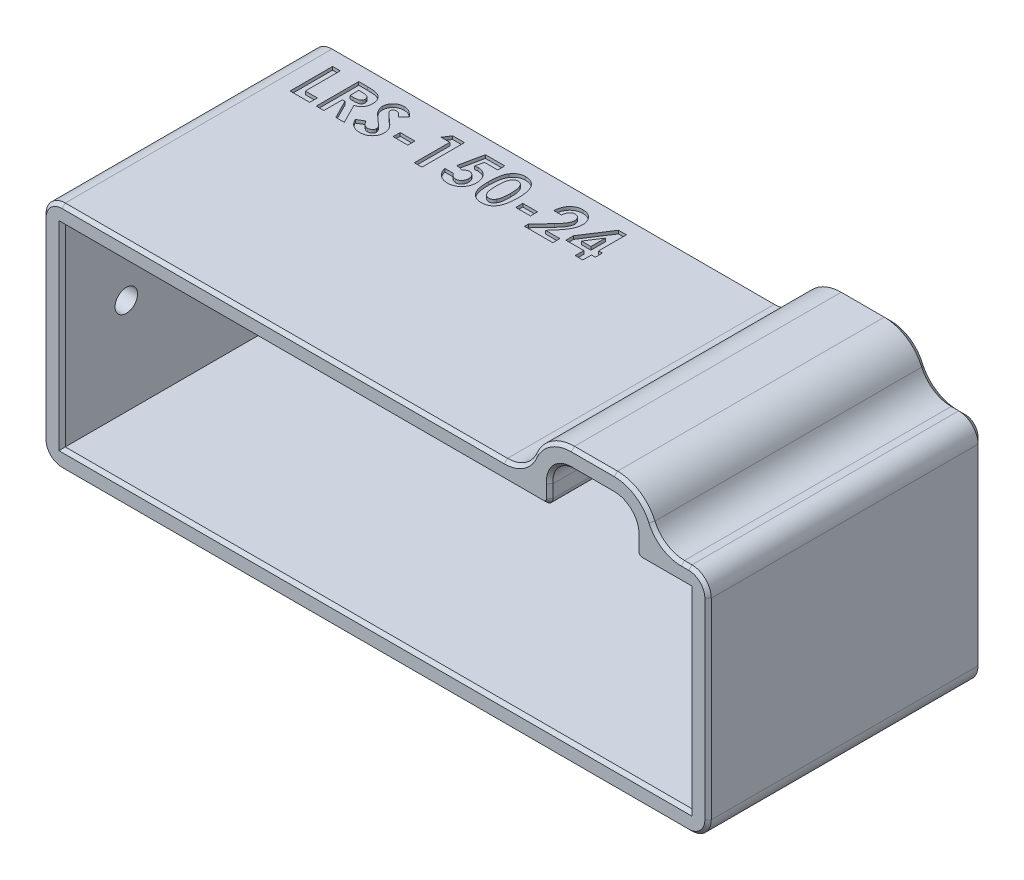
from build123d import *

# Parameters (mm, degrees)
SKETCH1_W           = 103.5
SKETCH1_H           = 36
SKETCH1_W_2         = 97.5
SKETCH1_H_2         = 30
BOSS_EXTRUDE1_DEPTH = 40
SKETCH1_2_W         = 103.5
SKETCH1_2_H         = 36
BOSS_EXTRUDE2_DEPTH = 3
SKETCH2_R           = 1.75
CUT_EXTRUDE1_DEPTH  = 3
BOSS_EXTRUDE3_DEPTH = 43
SKETCH4_W           = 13.363332499
SKETCH4_H           = 3
CUT_EXTRUDE3_DEPTH  = 40
CUT_EXTRUDE4_DEPTH  = 43
BOSS_EXTRUDE4_START = -3
BOSS_EXTRUDE4_DEPTH = 3
FILLET1_R           = 5
FILLET2_R           = 3
CHAMFER1_SIZE       = 1
SKETCH8_W           = 2.289663462
SKETCH8_H           = 1.102430556
SKETCH8_W_2         = 2.289663461
CUT_EXTRUDE5_DEPTH  = 0.5
FILLET3_R           = 1
CHAMFER2_SIZE       = 0.5
CHAMFER3_SIZE       = 0.5


with BuildPart() as part:
    # Sketch1 → Boss-Extrude1 (new body)
    with BuildSketch(Plane.XY):
        Rectangle(SKETCH1_W, SKETCH1_H)
        Rectangle(SKETCH1_W_2, SKETCH1_H_2, mode=Mode.SUBTRACT)
    extrude(amount=BOSS_EXTRUDE1_DEPTH)

    # Sketch1<2> → Boss-Extrude2 (add)
    with BuildSketch(Plane.XY):
        Rectangle(SKETCH1_2_W, SKETCH1_2_H)
    extrude(amount=-BOSS_EXTRUDE2_DEPTH)

    # Sketch2 → Cut-Extrude1 (cut)
    with BuildSketch(Plane.ZY.offset(51.75)):
        with Locations((30, 0)):
            Circle(SKETCH2_R)
    extrude(amount=-CUT_EXTRUDE1_DEPTH, mode=Mode.SUBTRACT)

    # Sketch3 → Boss-Extrude3 (add)
    with BuildSketch(Plane.XY.offset(40)):
        Polygon((-51.75, 24.7), (-51.75, 18), (-48.75, 18), (-48.75, 21.7), (30.470016264, 21.7), (37.170016264, 21.7), (48.75, 21.7), (48.75, 18), (51.75, 18), (51.75, 24.7), align=None)
        with BuildLine():
            Line((-48.75, 21.7), (-48.75, 18))
            Line((-48.75, 18), (27.138350015, 18))
            ThreePointArc((27.138350015, 18), (27.980538407, 20.591651177), (30.470016264, 21.7))
            Line((30.470016264, 21.7), (-48.75, 21.7))
        make_face()
        with BuildLine():
            ThreePointArc((37.170016264, 21.7), (39.659494121, 20.591651177), (40.501682514, 18))
            Line((40.501682514, 18), (48.75, 18))
            Line((48.75, 18), (48.75, 21.7))
            Line((48.75, 21.7), (37.170016264, 21.7))
        make_face()
    extrude(amount=-BOSS_EXTRUDE3_DEPTH)

    # Sketch4 → Cut-Extrude3 (cut)
    with BuildSketch(Plane.XY.offset(40)):
        with Locations((33.820016264, 16.5)):
            Rectangle(SKETCH4_W, SKETCH4_H)
    extrude(amount=-CUT_EXTRUDE3_DEPTH, mode=Mode.SUBTRACT)

    # Sketch6 → Cut-Extrude4 (cut)
    with BuildSketch(Plane.XY.offset(40)):
        with BuildLine():
            Line((-51.75, 17.867814868), (24.138350015, 17.867814868))
            ThreePointArc((24.138350015, 17.867814868), (25.812528981, 22.666284537), (30.470016264, 24.7))
            Line((30.470016264, 24.7), (-51.75, 24.7))
            Line((-51.75, 24.7), (-51.75, 17.867814868))
        make_face()
        with BuildLine():
            Line((43.501682514, 17.867814868), (51.75, 17.867814868))
            Line((51.75, 17.867814868), (51.75, 24.7))
            Line((51.75, 24.7), (37.170016264, 24.7))
            ThreePointArc((37.170016264, 24.7), (41.827503548, 22.666284537), (43.501682514, 17.867814868))
        make_face()
    extrude(amount=-CUT_EXTRUDE4_DEPTH, mode=Mode.SUBTRACT)

    # Sketch7 → Boss-Extrude4 (add)
    with BuildSketch(Plane(origin=(0, 0, -3), x_dir=(-1, 0, 0), z_dir=(0, 0, -1)).offset(BOSS_EXTRUDE4_START)):
        with BuildLine():
            Line((-40.501682514, 18), (-27.138350015, 18))
            ThreePointArc((-27.138350015, 18), (-27.980538407, 20.591651177), (-30.470016264, 21.7))
            Line((-30.470016264, 21.7), (-37.170016264, 21.7))
            ThreePointArc((-37.170016264, 21.7), (-39.659494121, 20.591651177), (-40.501682514, 18))
        make_face()
    extrude(amount=BOSS_EXTRUDE4_DEPTH)

    # Fillet1
    fillet1_edges = [part.edges().sort_by_distance(p)[0] for p in [
        (24.138350015, 17.867814868, 18.5),
        (43.501682514, 17.867814868, 18.5),
    ]]
    fillet(fillet1_edges, radius=FILLET1_R)

    # Fillet2
    fillet2_edges = [part.edges().sort_by_distance(p)[0] for p in [
        (-51.75, -18, 18.5),
        (51.75, -18, 18.5),
        (-51.75, 17.867814868, 18.5),
        (51.75, 17.867814868, 18.5),
    ]]
    fillet(fillet2_edges, radius=FILLET2_R)

    # Chamfer1
    chamfer1_edges = [part.edges().sort_by_distance(p)[0] for p in [
        (40.65371515, 23.659081095, -3),
        (-14.346042406, 17.867814868, -3),
        (44.839047351, 18.687436053, -3),
        (22.800985177, 18.687436053, -3),
        (51.75, -0.066092566, -3),
        (-51.75, -0.066092566, -3),
        (48.16605867, 17.867814868, -3),
        (0, -18, -3),
        (50.871320344, 16.989135212, -3),
        (-50.871320344, 16.989135212, -3),
        (-50.871320344, -17.121320344, -3),
        (50.871320344, -17.121320344, -3),
        (33.820016264, 24.7, -3),
        (26.986317378, 23.659081095, -3),
    ]]
    chamfer(chamfer1_edges, length=CHAMFER1_SIZE)

    # Sketch8 → Cut-Extrude5 (cut)
    # profile 1 of 10: a face of its own
    with BuildSketch(Plane(origin=(0, 17.867814868, 0), x_dir=(1, 0, 0), z_dir=(0, 1, 0))):
        Polygon((-46.353097305, -0.311028799), (-45.165864399, -0.311028799), (-45.165864399, -5.738379226), (-43.30021269, -5.738379226), (-43.30021269, -6.925612132), (-46.353097305, -6.925612132), align=None)
    # profile 2 of 10: a face of its own
    with BuildSketch(Plane(origin=(0, 17.867814868, 0), x_dir=(1, 0, 0), z_dir=(0, 1, 0))):
        with BuildLine():
            Line((-42.282584484, -0.311028799), (-40.899246143, -0.311028799))
            add(Edge.make_bspline(
                [(-40.899246143, -0.311028799), (-40.8078079, -0.311353352), (-40.631946401, -0.31197756), (-40.378363726, -0.321825899), (-40.145413165, -0.335530671), (-39.932749814, -0.356444517), (-39.740464655, -0.384173749), (-39.568364972, -0.416861926), (-39.416455797, -0.45411711), (-39.283455984, -0.50054001), (-39.163430229, -0.552904337), (-39.051549539, -0.613071909), (-38.94534566, -0.680372741), (-38.845528448, -0.7565777), (-38.75123047, -0.840315877), (-38.662273826, -0.931671564), (-38.579915557, -1.031419419), (-38.504665628, -1.138929161), (-38.436081375, -1.252026945), (-38.37546728, -1.370868054), (-38.326175797, -1.495535135), (-38.282621488, -1.624226478), (-38.25125073, -1.758781752), (-38.229432827, -1.897891037), (-38.213458612, -2.042044015), (-38.212540171, -2.139975147), (-38.212071664, -2.189930875)],
                knots=[0, 0, 0, 0, 1.749336639, 3.364467119, 4.854658419, 6.213483162, 7.451590619, 8.570285859, 9.5643256, 10.440900261, 11.26203566, 12.067320669, 12.869050712, 13.665104639, 14.467235401, 15.27997916, 16.102287765, 16.939272006, 17.78853747, 18.631303466, 19.488103222, 20.351255419, 21.228522269, 22.127379805, 23.044756219, 24, 24, 24, 24], degree=3))
            add(Edge.make_bspline(
                [(-38.212071664, -2.189930875), (-38.213288676, -2.24207318), (-38.215675014, -2.344314735), (-38.228529131, -2.49449924), (-38.252022419, -2.63818527), (-38.287606422, -2.77495213), (-38.328505611, -2.906502042), (-38.382891041, -3.030407828), (-38.444270374, -3.148471518), (-38.517168815, -3.259023058), (-38.597171292, -3.364518016), (-38.69021249, -3.460914491), (-38.790264769, -3.553393427), (-38.902952431, -3.636162258), (-39.0233081, -3.714817514), (-39.153723115, -3.786100121), (-39.293346345, -3.851801963), (-39.39150839, -3.888441848), (-39.441705745, -3.907178472)],
                knots=[0, 0, 0, 0, 1.099860209, 2.156625411, 3.176576793, 4.16617041, 5.135385252, 6.078461593, 7.016046972, 7.938469504, 8.868247731, 9.803980173, 10.76021508, 11.73834243, 12.748633912, 13.790971185, 14.870363756, 16, 16, 16, 16], degree=3))
            Line((-39.441705745, -3.907178472), (-37.915263437, -6.925612132))
            Line((-37.915263437, -6.925612132), (-39.235000016, -6.925612132))
            Line((-39.235000016, -6.925612132), (-40.692540414, -4.042332218))
            Line((-40.692540414, -4.042332218), (-41.095351578, -4.042332218))
            Line((-41.095351578, -4.042332218), (-41.095351578, -6.925612132))
            Line((-41.095351578, -6.925612132), (-42.282584484, -6.925612132))
            Line((-42.282584484, -6.925612132), (-42.282584484, -0.311028799))
        make_face()
        with BuildLine():
            Line((-41.095351578, -2.855099312), (-40.632913761, -2.855099312))
            add(Edge.make_bspline(
                [(-40.632913761, -2.855099312), (-40.576376894, -2.854462555), (-40.468120942, -2.853243304), (-40.312434664, -2.847587911), (-40.171034394, -2.833961209), (-40.043312912, -2.81674438), (-39.928627536, -2.796865064), (-39.828001217, -2.768376798), (-39.739883459, -2.7378509), (-39.665318459, -2.699915126), (-39.601611837, -2.656773924), (-39.546605246, -2.607764446), (-39.501106908, -2.551042216), (-39.463659456, -2.488148699), (-39.434529409, -2.418527618), (-39.413266706, -2.342943254), (-39.401384, -2.260534604), (-39.400016854, -2.203661414), (-39.39930457, -2.174030435)],
                knots=[0, 0, 0, 0, 1.688639943, 3.233382647, 4.650958383, 5.928841754, 7.082724185, 8.122798841, 9.049171256, 9.863274652, 10.613301712, 11.341792392, 12.054588806, 12.776240173, 13.521029143, 14.301969904, 15.115324896, 16, 16, 16, 16], degree=3))
            add(Edge.make_bspline(
                [(-39.39930457, -2.174030435), (-39.400651208, -2.138974823), (-39.40329643, -2.07011457), (-39.429545246, -1.97097995), (-39.471327692, -1.879224078), (-39.528599981, -1.795261527), (-39.600726983, -1.721654159), (-39.683498409, -1.656768678), (-39.778700665, -1.605462095), (-39.86685079, -1.571620819), (-39.9470468, -1.551373234), (-40.019421168, -1.536284913), (-40.103231123, -1.525591387), (-40.198539935, -1.514248999), (-40.30510466, -1.506894035), (-40.423506139, -1.501526377), (-40.553404324, -1.499330204), (-40.643955696, -1.498628126), (-40.691215377, -1.498261705)],
                knots=[0, 0, 0, 0, 1.020303359, 2.004196876, 2.966617323, 3.9489082, 4.950758222, 5.960522915, 7.003732012, 8.091992268, 8.70421221, 9.413913587, 10.24622431, 11.166358409, 12.212345909, 13.359657661, 14.621978493, 16, 16, 16, 16], degree=3))
            Line((-40.691215377, -1.498261705), (-41.095351578, -1.498261705))
            Line((-41.095351578, -1.498261705), (-41.095351578, -2.855099312))
        make_face(mode=Mode.SUBTRACT)
    # profile 3 of 10: a face of its own
    with BuildSketch(Plane(origin=(0, 17.867814868, 0), x_dir=(1, 0, 0), z_dir=(0, 1, 0))):
        with BuildLine():
            Line((-33.54794239, -1.194828295), (-34.435716996, -2.007075807))
            add(Edge.make_bspline(
                [(-34.435716996, -2.007075807), (-34.473745454, -1.953432715), (-34.546754789, -1.850445458), (-34.665095306, -1.712543093), (-34.782901455, -1.594902113), (-34.901264638, -1.498013968), (-35.021233981, -1.422467325), (-35.142601236, -1.368979468), (-35.264678337, -1.334976729), (-35.346695305, -1.33074257), (-35.387093365, -1.328657004)],
                knots=[0, 0, 0, 0, 1.299362458, 2.494594718, 3.587462134, 4.587049575, 5.512617175, 6.380583204, 7.202344345, 8, 8, 8, 8], degree=3))
            add(Edge.make_bspline(
                [(-35.387093365, -1.328657004), (-35.424775518, -1.329978514), (-35.497529853, -1.332530004), (-35.601246556, -1.357891618), (-35.693327722, -1.40166204), (-35.773683484, -1.45889555), (-35.837337103, -1.527848659), (-35.888159581, -1.600162742), (-35.916776907, -1.679981135), (-35.92054351, -1.734803627), (-35.922408202, -1.761944013)],
                knots=[0, 0, 0, 0, 1.185010067, 2.2879431, 3.333075148, 4.379039566, 5.372662701, 6.27520591, 7.14612461, 8, 8, 8, 8], degree=3))
            add(Edge.make_bspline(
                [(-35.922408202, -1.761944013), (-35.921239694, -1.789475775), (-35.918886482, -1.844920918), (-35.896157651, -1.92618268), (-35.861898813, -2.005584882), (-35.829163095, -2.05392078), (-35.812430154, -2.078627791)],
                knots=[0, 0, 0, 0, 0.967525499, 1.948461899, 2.951351359, 4, 4, 4, 4], degree=3))
            add(Edge.make_bspline(
                [(-35.812430154, -2.078627791), (-35.797218101, -2.097832291), (-35.762201962, -2.142038516), (-35.695433358, -2.212054286), (-35.611586014, -2.297829732), (-35.507433307, -2.396415288), (-35.387298903, -2.511356477), (-35.245614417, -2.638134917), (-35.086458147, -2.780676788), (-34.973333557, -2.879937786), (-34.914055254, -2.931951442)],
                knots=[0, 0, 0, 0, 0.473873513, 1.090794244, 1.870441696, 2.795289791, 3.865433203, 5.087734844, 6.473946851, 8, 8, 8, 8], degree=3))
            add(Edge.make_bspline(
                [(-34.914055254, -2.931951442), (-34.85841404, -2.980106106), (-34.752818575, -3.071493655), (-34.602577197, -3.201203607), (-34.470540049, -3.317900489), (-34.35478365, -3.419832929), (-34.257062754, -3.508070432), (-34.176966542, -3.583034772), (-34.113516775, -3.643266533), (-34.077449298, -3.679646552), (-34.06205664, -3.695172596)],
                knots=[0, 0, 0, 0, 1.543621617, 2.929473131, 4.163658386, 5.240097082, 6.164993805, 6.925417477, 7.541396219, 8, 8, 8, 8], degree=3))
            add(Edge.make_bspline(
                [(-34.06205664, -3.695172596), (-34.003660104, -3.758370154), (-33.891401453, -3.879858056), (-33.745504782, -4.068126097), (-33.625427101, -4.251914094), (-33.532532731, -4.434680315), (-33.462375166, -4.619061715), (-33.412913154, -4.809580236), (-33.383290025, -5.008226677), (-33.380001166, -5.143778623), (-33.37833769, -5.212339646)],
                knots=[0, 0, 0, 0, 1.206664779, 2.319633467, 3.337109185, 4.282041471, 5.190008762, 6.099243693, 7.03861361, 8, 8, 8, 8], degree=3))
            add(Edge.make_bspline(
                [(-33.37833769, -5.212339646), (-33.37952171, -5.279143955), (-33.381844802, -5.410216494), (-33.410298221, -5.602021631), (-33.450871127, -5.785587472), (-33.513603958, -5.958916561), (-33.590062361, -6.124854041), (-33.685914011, -6.280815135), (-33.798478631, -6.428378232), (-33.92749497, -6.564905463), (-34.07020236, -6.688794461), (-34.223269598, -6.799083374), (-34.388193454, -6.890140919), (-34.563564843, -6.965120313), (-34.749289893, -7.022870444), (-34.94514735, -7.065553174), (-35.151436791, -7.091170675), (-35.292500483, -7.093848681), (-35.364567741, -7.095216833)],
                knots=[0, 0, 0, 0, 1.043214005, 2.046824704, 3.02475056, 3.976699089, 4.921714032, 5.875962561, 6.831408892, 7.817874052, 8.806269674, 9.781291748, 10.760897367, 11.74438705, 12.757449933, 13.795994037, 14.874007457, 16, 16, 16, 16], degree=3))
            add(Edge.make_bspline(
                [(-35.364567741, -7.095216833), (-35.421139925, -7.094213205), (-35.533185292, -7.092225445), (-35.698323225, -7.075997044), (-35.857782567, -7.04980613), (-36.011383701, -7.012266728), (-36.159818628, -6.964699213), (-36.303093443, -6.906597316), (-36.440219074, -6.837060479), (-36.572233077, -6.757518656), (-36.698493702, -6.665160122), (-36.820597465, -6.561873116), (-36.937331514, -6.44606904), (-37.049256501, -6.318021764), (-37.155656297, -6.177368689), (-37.26001375, -6.026068671), (-37.357690901, -5.861313786), (-37.418030422, -5.745736901), (-37.44885051, -5.686702794)],
                knots=[0, 0, 0, 0, 1.016823716, 2.013894106, 2.979844003, 3.91962641, 4.853723003, 5.779685073, 6.695824784, 7.614987388, 8.547259901, 9.504950863, 10.487499108, 11.500346958, 12.559593716, 13.656357062, 14.802919212, 16, 16, 16, 16], degree=3))
            Line((-37.44885051, -5.686702794), (-36.40472157, -5.059960423))
            add(Edge.make_bspline(
                [(-36.40472157, -5.059960423), (-36.366170247, -5.126971848), (-36.292264064, -5.255438476), (-36.167023129, -5.428049674), (-36.038720185, -5.575862593), (-35.904388982, -5.696264629), (-35.765662939, -5.790865713), (-35.621871975, -5.858474211), (-35.472915066, -5.900323795), (-35.371452387, -5.905434595), (-35.320841529, -5.907983927)],
                knots=[0, 0, 0, 0, 1.283663364, 2.460892379, 3.537111102, 4.529833553, 5.449777664, 6.316464042, 7.160231139, 8, 8, 8, 8], degree=3))
            add(Edge.make_bspline(
                [(-35.320841529, -5.907983927), (-35.269363041, -5.905902005), (-35.169487277, -5.901862772), (-35.026927405, -5.864553598), (-34.896223116, -5.805975458), (-34.783243293, -5.72239253), (-34.687579103, -5.625925127), (-34.61697344, -5.518600731), (-34.572618486, -5.402478325), (-34.567929092, -5.321812063), (-34.565570596, -5.281241556)],
                knots=[0, 0, 0, 0, 1.13588714, 2.203786484, 3.234766741, 4.283437687, 5.291419208, 6.222934724, 7.106237994, 8, 8, 8, 8], degree=3))
            add(Edge.make_bspline(
                [(-34.565570596, -5.281241556), (-34.567748571, -5.243497301), (-34.572172918, -5.16682346), (-34.604761299, -5.052821788), (-34.655706879, -4.938871962), (-34.715979092, -4.845407232), (-34.777313616, -4.767151747), (-34.835963255, -4.699346909), (-34.907383001, -4.624434433), (-34.991391764, -4.542320086), (-35.08687957, -4.452280994), (-35.193926855, -4.354325973), (-35.313759423, -4.249317891), (-35.398457319, -4.177787423), (-35.442744908, -4.140384935)],
                knots=[0, 0, 0, 0, 0.916159276, 1.861089862, 2.860218735, 3.940849679, 4.552606315, 5.27541173, 6.11797699, 7.06649574, 8.129236253, 9.306560635, 10.591630461, 12, 12, 12, 12], degree=3))
            add(Edge.make_bspline(
                [(-35.442744908, -4.140384935), (-35.526937378, -4.069150032), (-35.68852821, -3.932428693), (-35.916876558, -3.730495578), (-36.122638866, -3.541770579), (-36.304037949, -3.363920643), (-36.463385112, -3.200230245), (-36.599601187, -3.04936983), (-36.711189779, -2.910175716), (-36.82861271, -2.745309603), (-36.940187972, -2.544408915), (-37.036620661, -2.302702099), (-37.099182119, -2.061025951), (-37.10619126, -1.898777897), (-37.109641108, -1.818920592)],
                knots=[0, 0, 0, 0, 1.345494975, 2.582412109, 3.71882943, 4.751509156, 5.681369928, 6.505683931, 7.230279997, 7.856715994, 8.973648664, 10.023341002, 11.027102913, 12, 12, 12, 12], degree=3))
            add(Edge.make_bspline(
                [(-37.109641108, -1.818920592), (-37.108206321, -1.762290078), (-37.105379636, -1.650721883), (-37.080165171, -1.486677107), (-37.042481192, -1.328387681), (-36.987753236, -1.176431119), (-36.916722956, -1.030997751), (-36.830459441, -0.891375619), (-36.727623181, -0.758849776), (-36.611733659, -0.633508074), (-36.484053076, -0.518960023), (-36.347610148, -0.41785989), (-36.203177153, -0.332469248), (-36.051637659, -0.26163151), (-35.892052639, -0.207409721), (-35.725597749, -0.168974615), (-35.552034239, -0.146114639), (-35.433980085, -0.143007091), (-35.373842998, -0.141424098)],
                knots=[0, 0, 0, 0, 1.010766082, 1.991317756, 2.957454644, 3.913069143, 4.869106762, 5.843196583, 6.838735724, 7.860187025, 8.887984031, 9.89767229, 10.887916223, 11.879572884, 12.879850636, 13.892031539, 14.926195476, 16, 16, 16, 16], degree=3))
            add(Edge.make_bspline(
                [(-35.373842998, -0.141424098), (-35.295908309, -0.144275115), (-35.140654121, -0.149954644), (-34.911106325, -0.194366705), (-34.686893635, -0.264209349), (-34.506218848, -0.348466814), (-34.362459293, -0.430087061), (-34.252281022, -0.505232703), (-34.140168701, -0.591316075), (-34.025218214, -0.688608447), (-33.909565519, -0.798942937), (-33.789922055, -0.919692945), (-33.667918112, -1.051902033), (-33.588634894, -1.146351592), (-33.54794239, -1.194828295)],
                knots=[0, 0, 0, 0, 1.282922637, 2.555718331, 3.837320111, 5.142675274, 5.830281639, 6.55870424, 7.337177975, 8.157850921, 9.037902056, 9.96903443, 10.957596896, 12, 12, 12, 12], degree=3))
        make_face()
    # profile 4 of 10: a face of its own
    with BuildSketch(Plane(origin=(0, 17.867814868, 0), x_dir=(1, 0, 0), z_dir=(0, 1, 0))):
        with Locations((-31.046273053, -4.508745145)):
            Rectangle(SKETCH8_W, SKETCH8_H)
    # profile 5 of 10: a face of its own
    with BuildSketch(Plane(origin=(0, 17.867814868, 0), x_dir=(1, 0, 0), z_dir=(0, 1, 0))):
        Polygon((-27.666104366, -0.311028799), (-25.830928502, -0.311028799), (-25.830928502, -6.925612132), (-27.018161408, -6.925612132), (-27.018161408, -1.413459354), (-28.374999014, -1.413459354), align=None)
    # profile 6 of 10: a face of its own
    with BuildSketch(Plane(origin=(0, 17.867814868, 0), x_dir=(1, 0, 0), z_dir=(0, 1, 0))):
        with BuildLine():
            Line((-22.567363047, -0.311028799), (-19.55555457, -0.311028799))
            Line((-19.55555457, -0.311028799), (-19.55555457, -1.413459354))
            Line((-19.55555457, -1.413459354), (-21.626586972, -1.413459354))
            Line((-21.626586972, -1.413459354), (-21.884969133, -2.664294023))
            add(Edge.make_bspline(
                [(-21.884969133, -2.664294023), (-21.849760865, -2.654488076), (-21.780322926, -2.635148733), (-21.675714585, -2.61575382), (-21.574334525, -2.603182653), (-21.507809548, -2.601505827), (-21.475532785, -2.60069226)],
                knots=[0, 0, 0, 0, 1.05461699, 2.079921384, 3.068411212, 4, 4, 4, 4], degree=3))
            add(Edge.make_bspline(
                [(-21.475532785, -2.60069226), (-21.405198337, -2.602303933), (-21.266553646, -2.605480896), (-21.063734057, -2.635640635), (-20.869522318, -2.68314131), (-20.68451274, -2.750887073), (-20.508886052, -2.839059934), (-20.34242936, -2.945724378), (-20.184938366, -3.071067748), (-20.039210774, -3.215168519), (-19.905310175, -3.373394428), (-19.788891241, -3.544532491), (-19.689462206, -3.726142445), (-19.610379789, -3.919353175), (-19.547961204, -4.122951186), (-19.50285614, -4.33706695), (-19.476183263, -4.561954227), (-19.472586589, -4.715378737), (-19.470752219, -4.793628041)],
                knots=[0, 0, 0, 0, 1.01440847, 1.999622559, 2.951875003, 3.895578053, 4.836219714, 5.782137149, 6.743708247, 7.735272588, 8.734977101, 9.730283169, 10.717124674, 11.717316708, 12.737475749, 13.78628267, 14.87096371, 16, 16, 16, 16], degree=3))
            add(Edge.make_bspline(
                [(-19.470752219, -4.793628041), (-19.472993848, -4.872765656), (-19.477417238, -5.028927302), (-19.506275799, -5.258540161), (-19.557211678, -5.478457444), (-19.627177204, -5.689267864), (-19.719352305, -5.889422016), (-19.830205481, -6.080993346), (-19.961610958, -6.262559883), (-20.112279198, -6.432260348), (-20.276075339, -6.587369832), (-20.450479565, -6.723819941), (-20.634266631, -6.838641603), (-20.827440974, -6.931436918), (-21.028894291, -7.004854919), (-21.238687724, -7.058299719), (-21.457840843, -7.088947343), (-21.606617337, -7.093104038), (-21.682238514, -7.095216833)],
                knots=[0, 0, 0, 0, 1.06808661, 2.107647099, 3.116961351, 4.110378221, 5.100014249, 6.085620622, 7.093190682, 8.119403071, 9.144090782, 10.133780668, 11.103064255, 12.062861538, 13.020824475, 13.992378307, 14.979551724, 16, 16, 16, 16], degree=3))
            add(Edge.make_bspline(
                [(-21.682238514, -7.095216833), (-21.749864282, -7.093488435), (-21.883236449, -7.090079673), (-22.079687795, -7.069127626), (-22.269088708, -7.032084211), (-22.450433677, -6.978472797), (-22.625630752, -6.912489386), (-22.792654607, -6.82996466), (-22.952423066, -6.732470002), (-23.104482447, -6.621784692), (-23.246362, -6.497101983), (-23.375854623, -6.360615276), (-23.49374428, -6.214044918), (-23.597508316, -6.055582679), (-23.686821464, -5.885462675), (-23.766026185, -5.705689811), (-23.830856042, -5.514386685), (-23.863755328, -5.381764729), (-23.880474442, -5.314367474)],
                knots=[0, 0, 0, 0, 1.054957082, 2.080596141, 3.077793124, 4.061112343, 5.027190972, 5.994718051, 6.962465889, 7.943658696, 8.924948258, 9.904494768, 10.875059, 11.855380583, 12.854004648, 13.869083016, 14.917087635, 16, 16, 16, 16], degree=3))
            Line((-23.880474442, -5.314367474), (-22.523636835, -5.314367474))
            add(Edge.make_bspline(
                [(-22.523636835, -5.314367474), (-22.498833811, -5.361071027), (-22.450631964, -5.451834053), (-22.358941394, -5.572335608), (-22.256299623, -5.675094158), (-22.143632534, -5.761113674), (-22.020210116, -5.825558032), (-21.891061598, -5.874429652), (-21.754564542, -5.902670751), (-21.66160402, -5.906201168), (-21.614661641, -5.907983927)],
                knots=[0, 0, 0, 0, 1.104910296, 2.147267069, 3.153527244, 4.136738762, 5.099945312, 6.05603338, 7.018353, 8, 8, 8, 8], degree=3))
            add(Edge.make_bspline(
                [(-21.614661641, -5.907983927), (-21.581943433, -5.906752917), (-21.517569807, -5.904330883), (-21.422725449, -5.891517715), (-21.332192342, -5.867249867), (-21.245297394, -5.833644539), (-21.161807184, -5.791734899), (-21.082918573, -5.738826709), (-21.007259041, -5.677927421), (-20.935980432, -5.608045282), (-20.871422558, -5.530142952), (-20.814812364, -5.446431587), (-20.764195044, -5.358771273), (-20.726702021, -5.263689564), (-20.695998405, -5.164025633), (-20.673387021, -5.059027686), (-20.659874169, -4.948573094), (-20.65862324, -4.87316884), (-20.657985125, -4.834704179)],
                knots=[0, 0, 0, 0, 0.978869489, 1.925942215, 2.855067702, 3.774946051, 4.70828698, 5.642468714, 6.60995405, 7.609372294, 8.622401667, 9.629904756, 10.629323, 11.642352373, 12.678539694, 13.745912462, 14.850161547, 16, 16, 16, 16], degree=3))
            add(Edge.make_bspline(
                [(-20.657985125, -4.834704179), (-20.658725731, -4.797132371), (-20.660167338, -4.723997935), (-20.672092598, -4.616610386), (-20.693426658, -4.514719036), (-20.722494498, -4.417543474), (-20.759704804, -4.325673798), (-20.805178285, -4.238563153), (-20.859109209, -4.156651854), (-20.921787118, -4.081607532), (-20.988626197, -4.012774747), (-21.060432844, -3.952574141), (-21.13656012, -3.902611818), (-21.214642465, -3.858993256), (-21.297796643, -3.827248618), (-21.384152853, -3.805387257), (-21.473620278, -3.789346269), (-21.534644067, -3.788403803), (-21.565635282, -3.787925166)],
                knots=[0, 0, 0, 0, 1.166249705, 2.270133367, 3.348514167, 4.393962215, 5.415026464, 6.420877785, 7.440098956, 8.453121383, 9.451844239, 10.415694839, 11.355045125, 12.27538808, 13.187007209, 14.108269027, 15.039275622, 16, 16, 16, 16], degree=3))
            add(Edge.make_bspline(
                [(-21.565635282, -3.787925166), (-21.599298945, -3.789202515), (-21.666768147, -3.791762597), (-21.767010494, -3.812593295), (-21.866044198, -3.846305179), (-21.964419986, -3.892816066), (-22.06116131, -3.953684142), (-22.158821219, -4.025075416), (-22.254130828, -4.112177141), (-22.314731329, -4.177050705), (-22.346081914, -4.210611882)],
                knots=[0, 0, 0, 0, 0.88288272, 1.769486374, 2.674910571, 3.623812639, 4.617874466, 5.670434592, 6.794841017, 8, 8, 8, 8], degree=3))
            Line((-22.346081914, -4.210611882), (-23.345159605, -3.981380528))
            Line((-23.345159605, -3.981380528), (-22.567363047, -0.311028799))
        make_face()
    # profile 7 of 10: a face of its own
    with BuildSketch(Plane(origin=(0, 17.867814868, 0), x_dir=(1, 0, 0), z_dir=(0, 1, 0))):
        with BuildLine():
            add(Edge.make_bspline(
                [(-16.48014433, -0.141424098), (-16.42267733, -0.142277212), (-16.309681853, -0.143954661), (-16.143260786, -0.162122808), (-15.982951286, -0.189569811), (-15.828126202, -0.227848808), (-15.679899981, -0.278509698), (-15.537193801, -0.339149915), (-15.401706281, -0.412950163), (-15.271709519, -0.496311333), (-15.147253593, -0.590687995), (-15.031329711, -0.698282263), (-14.921820859, -0.816618388), (-14.8210975, -0.9474854), (-14.726929083, -1.089692925), (-14.639625032, -1.243263512), (-14.559853679, -1.408948786), (-14.486720979, -1.587047741), (-14.421325487, -1.780230002), (-14.366242945, -1.990711453), (-14.319000449, -2.218540161), (-14.279124448, -2.464283228), (-14.248984637, -2.728267304), (-14.228669798, -3.01031701), (-14.214728793, -3.309888598), (-14.213591025, -3.515392245), (-14.213006493, -3.620970539)],
                knots=[0, 0, 0, 0, 0.879237366, 1.728815576, 2.559023295, 3.367336655, 4.166867292, 4.954216142, 5.737608147, 6.525189134, 7.316157332, 8.124696809, 8.942788509, 9.781158001, 10.649253743, 11.551476218, 12.482711956, 13.461909668, 14.496590415, 15.601789533, 16.789733467, 18.056700938, 19.410929216, 20.8549011, 22.384193279, 24, 24, 24, 24], degree=3))
            add(Edge.make_bspline(
                [(-14.213006493, -3.620970539), (-14.213638215, -3.727869736), (-14.214865639, -3.935572957), (-14.228090266, -4.237884579), (-14.250863699, -4.521982136), (-14.280215743, -4.787836236), (-14.320420015, -5.035306487), (-14.367504806, -5.26503367), (-14.423456808, -5.476934514), (-14.491006407, -5.670531562), (-14.563696433, -5.848943297), (-14.643685995, -6.014305525), (-14.729580885, -6.167066138), (-14.819410934, -6.309529737), (-14.918100954, -6.437496569), (-15.020847425, -6.555318174), (-15.132124112, -6.658506576), (-15.247245835, -6.752379643), (-15.37042997, -6.833504812), (-15.50040615, -6.904455547), (-15.639491625, -6.96200502), (-15.785151104, -7.012058477), (-15.939867381, -7.047991459), (-16.101182037, -7.076503099), (-16.270916282, -7.092260381), (-16.386478192, -7.094215175), (-16.445693375, -7.095216833)],
                knots=[0, 0, 0, 0, 1.643780988, 3.193836972, 4.651895693, 6.025988579, 7.305620092, 8.505800249, 9.631074763, 10.672816429, 11.65661981, 12.592235626, 13.49536222, 14.350718032, 15.179365177, 15.97804903, 16.751647189, 17.51006938, 18.259804725, 19.016521909, 19.783502495, 20.571750527, 21.382245291, 22.22305063, 23.089471752, 24, 24, 24, 24], degree=3))
            add(Edge.make_bspline(
                [(-16.445693375, -7.095216833), (-16.504906961, -7.094195854), (-16.620905504, -7.09219577), (-16.791098726, -7.076620261), (-16.953268269, -7.047875958), (-17.109208601, -7.01178261), (-17.257834402, -6.962115768), (-17.399858328, -6.902844456), (-17.534188339, -6.832336418), (-17.661196373, -6.751022236), (-17.780448788, -6.657777251), (-17.893798767, -6.553598822), (-18.000995572, -6.438751016), (-18.100408474, -6.311947442), (-18.19366557, -6.174880663), (-18.279794334, -6.025985444), (-18.358743006, -5.865478571), (-18.432981115, -5.693136316), (-18.497484635, -5.505248346), (-18.554889772, -5.300136847), (-18.601914551, -5.076092044), (-18.639735024, -4.833185915), (-18.669930869, -4.571933067), (-18.692393106, -4.2922074), (-18.70569119, -3.993878625), (-18.706905742, -3.788822398), (-18.707531066, -3.683247265)],
                knots=[0, 0, 0, 0, 0.917216111, 1.796812873, 2.643793957, 3.46689424, 4.273913431, 5.068098542, 5.848489301, 6.620921603, 7.401012384, 8.190319798, 9.003608147, 9.831726257, 10.68377682, 11.569763213, 12.493818149, 13.453288342, 14.474581811, 15.568529029, 16.750744269, 18.018426408, 19.375425659, 20.823733699, 22.36466933, 24, 24, 24, 24], degree=3))
            add(Edge.make_bspline(
                [(-18.707531066, -3.683247265), (-18.706398351, -3.536558929), (-18.704212763, -3.253521895), (-18.676515385, -2.844615673), (-18.635862659, -2.466652704), (-18.576153435, -2.120265226), (-18.502323805, -1.804170322), (-18.40778112, -1.520450259), (-18.30015115, -1.265179134), (-18.208436588, -1.113954982), (-18.164266008, -1.041124035)],
                knots=[0, 0, 0, 0, 1.288568992, 2.486310467, 3.599230591, 4.627010532, 5.572937695, 6.447898582, 7.252493626, 8, 8, 8, 8], degree=3))
            add(Edge.make_bspline(
                [(-18.164266008, -1.041124035), (-18.112906562, -0.969574934), (-18.012488724, -0.829682345), (-17.836905328, -0.646029524), (-17.64826383, -0.488960638), (-17.44268964, -0.362030298), (-17.223434001, -0.261933021), (-16.988614491, -0.191235441), (-16.739098258, -0.150043737), (-16.5677513, -0.144340217), (-16.48014433, -0.141424098)],
                knots=[0, 0, 0, 0, 1.058512271, 2.069600068, 3.047294572, 4.004278952, 4.967380941, 5.939006123, 6.946246673, 8, 8, 8, 8], degree=3))
        make_face()
        with BuildLine():
            add(Edge.make_bspline(
                [(-16.450993522, -1.328657004), (-16.502944167, -1.331119361), (-16.604795008, -1.335946889), (-16.752585431, -1.376925785), (-16.891942572, -1.4402199), (-16.997947827, -1.516384471), (-17.077291706, -1.589397346), (-17.132729844, -1.655471624), (-17.186191189, -1.729205756), (-17.233410942, -1.813926984), (-17.277998715, -1.906591175), (-17.321574409, -2.007618968), (-17.357295036, -2.119491825), (-17.392389604, -2.240304537), (-17.423135721, -2.373397253), (-17.448894226, -2.519857861), (-17.471907187, -2.680638807), (-17.487959001, -2.855845402), (-17.502924109, -3.045294338), (-17.513651807, -3.249407633), (-17.518136788, -3.468130221), (-17.519562428, -3.618761222), (-17.52029816, -3.696497632)],
                knots=[0, 0, 0, 0, 1.076674018, 2.110852608, 3.161083442, 4.239746716, 4.804137807, 5.395870207, 6.026861976, 6.692161227, 7.405688833, 8.16177676, 8.973626916, 9.841385931, 10.773283133, 11.807421078, 12.927755683, 14.143907515, 15.458935494, 16.872852025, 18.386167141, 20, 20, 20, 20], degree=3))
            add(Edge.make_bspline(
                [(-17.52029816, -3.696497632), (-17.519087234, -3.79720891), (-17.516765194, -3.990330252), (-17.504603434, -4.268045467), (-17.480226194, -4.520788674), (-17.449905831, -4.750272809), (-17.407319642, -4.955009605), (-17.358321475, -5.136936062), (-17.297813095, -5.29373306), (-17.227884004, -5.427668235), (-17.150434384, -5.541606611), (-17.066359415, -5.638454743), (-16.978521548, -5.722320657), (-16.884179078, -5.790443905), (-16.783557076, -5.842650422), (-16.677495553, -5.880201925), (-16.565927108, -5.903188764), (-16.489526186, -5.906376299), (-16.450993522, -5.907983927)],
                knots=[0, 0, 0, 0, 1.771748488, 3.397459088, 4.888034009, 6.237357457, 7.467047327, 8.564189669, 9.548206622, 10.417051504, 11.216568818, 11.965764335, 12.669334354, 13.348544111, 14.005342236, 14.656555988, 15.322436492, 16, 16, 16, 16], degree=3))
            add(Edge.make_bspline(
                [(-16.450993522, -5.907983927), (-16.413783177, -5.906883869), (-16.340929949, -5.904730091), (-16.234693626, -5.882621856), (-16.13422901, -5.846678668), (-16.039839435, -5.795834504), (-15.951187283, -5.731178371), (-15.868705831, -5.652426142), (-15.793017138, -5.55879284), (-15.748920561, -5.489303082), (-15.726198433, -5.45349633)],
                knots=[0, 0, 0, 0, 0.992283464, 1.942767638, 2.88273346, 3.832339453, 4.79467288, 5.803907806, 6.868395428, 8, 8, 8, 8], degree=3))
            add(Edge.make_bspline(
                [(-15.726198433, -5.45349633), (-15.699446955, -5.404567548), (-15.643351273, -5.301967861), (-15.578437254, -5.128834714), (-15.523796251, -4.93356914), (-15.476767538, -4.715563453), (-15.444602768, -4.473957811), (-15.416902506, -4.210284258), (-15.403541982, -3.923215039), (-15.40136882, -3.724332449), (-15.400239399, -3.620970539)],
                knots=[0, 0, 0, 0, 0.710965849, 1.490837728, 2.352621235, 3.297892224, 4.334225155, 5.461620853, 6.680770821, 8, 8, 8, 8], degree=3))
            add(Edge.make_bspline(
                [(-15.400239399, -3.620970539), (-15.40067567, -3.516711398), (-15.401515417, -3.31603035), (-15.416922344, -3.027929097), (-15.438377668, -2.764796417), (-15.469760613, -2.527219779), (-15.510140475, -2.31462245), (-15.559908808, -2.127018328), (-15.61858197, -1.964037681), (-15.688161348, -1.825843023), (-15.765224833, -1.708396521), (-15.847030074, -1.607636533), (-15.933922978, -1.521610197), (-16.025758231, -1.449993781), (-16.124661393, -1.395273468), (-16.228743284, -1.3566364), (-16.33821728, -1.33326227), (-16.412894044, -1.330212812), (-16.450993522, -1.328657004)],
                knots=[0, 0, 0, 0, 1.793836731, 3.452829483, 4.963243077, 6.335886805, 7.574563692, 8.684454726, 9.672768357, 10.54971625, 11.340229787, 12.085688095, 12.778991901, 13.440269426, 14.083255152, 14.715733572, 15.344777694, 16, 16, 16, 16], degree=3))
        make_face(mode=Mode.SUBTRACT)
    # profile 8 of 10: a face of its own
    with BuildSketch(Plane(origin=(0, 17.867814868, 0), x_dir=(1, 0, 0), z_dir=(0, 1, 0))):
        with Locations((-11.965744207, -4.508745145)):
            Rectangle(SKETCH8_W_2, SKETCH8_H)
    # profile 9 of 10: a face of its own
    with BuildSketch(Plane(origin=(0, 17.867814868, 0), x_dir=(1, 0, 0), z_dir=(0, 1, 0))):
        with BuildLine():
            Line((-8.531249014, -2.51588991), (-9.71848192, -2.51588991))
            add(Edge.make_bspline(
                [(-9.71848192, -2.51588991), (-9.713354443, -2.426082022), (-9.703335662, -2.2506028), (-9.663483479, -1.995713611), (-9.610082923, -1.754871357), (-9.538812792, -1.528918529), (-9.449257208, -1.317937232), (-9.343720668, -1.121208218), (-9.219506954, -0.939767271), (-9.07925974, -0.774489401), (-8.92536004, -0.626217099), (-8.761002963, -0.49474956), (-8.583674444, -0.386265856), (-8.396614422, -0.296993812), (-8.199854748, -0.225669596), (-7.991533767, -0.177983587), (-7.773455236, -0.145690154), (-7.624162822, -0.142864349), (-7.548071764, -0.141424098)],
                knots=[0, 0, 0, 0, 1.199038563, 2.342849363, 3.436047546, 4.486744587, 5.497670872, 6.488682221, 7.459191391, 8.424610317, 9.374430501, 10.305433194, 11.225809216, 12.140057399, 13.06607119, 14.010487599, 14.985989317, 16, 16, 16, 16], degree=3))
            add(Edge.make_bspline(
                [(-7.548071764, -0.141424098), (-7.45467107, -0.144338446), (-7.272331027, -0.150027936), (-7.007376482, -0.198561174), (-6.759937906, -0.279740515), (-6.530195164, -0.393169462), (-6.320104096, -0.53726905), (-6.129699541, -0.709084226), (-5.964739637, -0.91221976), (-5.824178488, -1.138223517), (-5.707388973, -1.377529687), (-5.625547746, -1.624982191), (-5.571754388, -1.874014642), (-5.566016993, -2.04170049), (-5.563166749, -2.125004076)],
                knots=[0, 0, 0, 0, 1.075374347, 2.099382735, 3.09057751, 4.06680945, 5.040638231, 6.016817125, 7.011024321, 8.044445721, 9.0776792, 10.070479129, 11.0414456, 12, 12, 12, 12], degree=3))
            add(Edge.make_bspline(
                [(-5.563166749, -2.125004076), (-5.564276484, -2.175391972), (-5.566510105, -2.276810361), (-5.58204077, -2.430281275), (-5.605339837, -2.586609343), (-5.640469151, -2.74566053), (-5.684278286, -2.90747942), (-5.737425099, -3.07255028), (-5.801142382, -3.239937221), (-5.874366824, -3.411524152), (-5.961723769, -3.58786815), (-6.063438788, -3.77161268), (-6.182211629, -3.962594746), (-6.316607666, -4.161892696), (-6.467279628, -4.369192204), (-6.634963046, -4.583868821), (-6.8177266, -4.806678998), (-6.947439036, -4.955615098), (-7.014081964, -5.032134652)],
                knots=[0, 0, 0, 0, 0.728284026, 1.46585585, 2.227944881, 3.01186502, 3.81876927, 4.650621989, 5.517437689, 6.406905708, 7.346299482, 8.360816762, 9.441613733, 10.596154504, 11.834900912, 13.145207542, 14.533280747, 16, 16, 16, 16], degree=3))
            Line((-7.014081964, -5.032134652), (-7.704426098, -5.823181577))
            Line((-7.704426098, -5.823181577), (-5.478364399, -5.823181577))
            Line((-5.478364399, -5.823181577), (-5.478364399, -6.925612132))
            Line((-5.478364399, -6.925612132), (-9.888086621, -6.925612132))
            Line((-9.888086621, -6.925612132), (-9.888086621, -6.324045459))
            Line((-9.888086621, -6.324045459), (-7.929682341, -4.23976269))
            add(Edge.make_bspline(
                [(-7.929682341, -4.23976269), (-7.872981504, -4.178963514), (-7.763168799, -4.061213541), (-7.606916636, -3.888285179), (-7.465522231, -3.724180291), (-7.341917511, -3.567151491), (-7.229615862, -3.422292155), (-7.133624803, -3.285236041), (-7.053066093, -3.157222186), (-6.965608187, -3.002859834), (-6.882551926, -2.818755261), (-6.80634278, -2.606659244), (-6.759888032, -2.403944298), (-6.753475807, -2.271850882), (-6.750399655, -2.20848139)],
                knots=[0, 0, 0, 0, 1.246127091, 2.413378631, 3.493388633, 4.492180848, 5.408488754, 6.240484944, 6.999099869, 7.674939598, 8.898438119, 10.020720584, 11.050475521, 12, 12, 12, 12], degree=3))
            add(Edge.make_bspline(
                [(-6.750399655, -2.20848139), (-6.75269962, -2.147176295), (-6.75715617, -2.028387844), (-6.806130041, -1.859411906), (-6.88200206, -1.706421443), (-6.988916451, -1.573987983), (-7.118423263, -1.465158628), (-7.26808055, -1.384214411), (-7.436668165, -1.337509969), (-7.554851294, -1.331664241), (-7.615648637, -1.328657004)],
                knots=[0, 0, 0, 0, 1.062038974, 2.057870785, 3.028805853, 4.01125022, 4.991535629, 5.949134679, 6.94496649, 8, 8, 8, 8], degree=3))
            add(Edge.make_bspline(
                [(-7.615648637, -1.328657004), (-7.647057319, -1.329767913), (-7.708890353, -1.331954917), (-7.79978008, -1.346513209), (-7.886268185, -1.372170678), (-7.969317329, -1.406548076), (-8.04804119, -1.452115563), (-8.122241201, -1.508284751), (-8.192699152, -1.573628253), (-8.259091897, -1.647941749), (-8.319517961, -1.730875632), (-8.373188171, -1.821672471), (-8.417564499, -1.920275905), (-8.456635032, -2.025384219), (-8.486768096, -2.138126362), (-8.508708705, -2.257827584), (-8.525388685, -2.384293147), (-8.529260035, -2.47122633), (-8.531249014, -2.51588991)],
                knots=[0, 0, 0, 0, 0.903469896, 1.778625579, 2.63899355, 3.493148037, 4.358286772, 5.247621495, 6.164656832, 7.118446693, 8.109501108, 9.111810964, 10.146451449, 11.215617525, 12.33435995, 13.498009769, 14.714554818, 16, 16, 16, 16], degree=3))
        make_face()
    # profile 10 of 10: a face of its own
    with BuildSketch(Plane(origin=(0, 17.867814868, 0), x_dir=(1, 0, 0), z_dir=(0, 1, 0))):
        Polygon((-2.051819427, -0.141424098), (-0.814235125, -0.141424098), (-0.814235125, -4.46634397), (-0.220618672, -4.46634397), (-0.220618672, -5.568774525), (-0.814235125, -5.568774525), (-0.814235125, -6.925612132), (-2.001468031, -6.925612132), (-2.001468031, -5.568774525), (-4.799945596, -5.568774525), (-4.799945596, -4.366966215), align=None)
        Polygon((-2.001468031, -4.46634397), (-2.001468031, -2.215106573), (-3.465633613, -4.46634397), align=None, mode=Mode.SUBTRACT)
    extrude(amount=-CUT_EXTRUDE5_DEPTH, mode=Mode.SUBTRACT)

    # Fillet3
    fillet3_edges = [part.edges().sort_by_distance(p)[0] for p in [
        (40.501682514, 15, 20),
        (27.138350015, 15, 20),
    ]]
    fillet(fillet3_edges, radius=FILLET3_R)

    # Chamfer2
    chamfer2_edges = [part.edges().sort_by_distance(p)[0] for p in [
        (48.75, 0, 40),
        (45.125841257, 15, 40),
        (-48.75, 0, 40),
        (0, -15, 40),
        (39.659494121, 20.591651177, 40),
        (27.980538407, 20.591651177, 40),
        (33.820016264, 21.7, 40),
        (40.501682514, 17, 40),
        (-11.305824993, 15, 40),
        (26.845456796, 15.292893219, 40),
        (40.794575733, 15.292893219, 40),
        (27.138350015, 17, 40),
    ]]
    chamfer(chamfer2_edges, length=CHAMFER2_SIZE)

    # Chamfer3
    chamfer3_edges = [part.edges().sort_by_distance(p)[0] for p in [
        (40.65371515, 23.659081095, 40),
        (-14.346042406, 17.867814868, 40),
        (44.839047351, 18.687436053, 40),
        (22.800985177, 18.687436053, 40),
        (51.75, -0.066092566, 40),
        (0, -18, 40),
        (-51.75, -0.066092566, 40),
        (48.16605867, 17.867814868, 40),
        (50.871320344, 16.989135212, 40),
        (-50.871320344, 16.989135212, 40),
        (-50.871320344, -17.121320344, 40),
        (50.871320344, -17.121320344, 40),
        (33.820016264, 24.7, 40),
        (26.986317378, 23.659081095, 40),
    ]]
    chamfer(chamfer3_edges, length=CHAMFER3_SIZE)


solid = part.part
